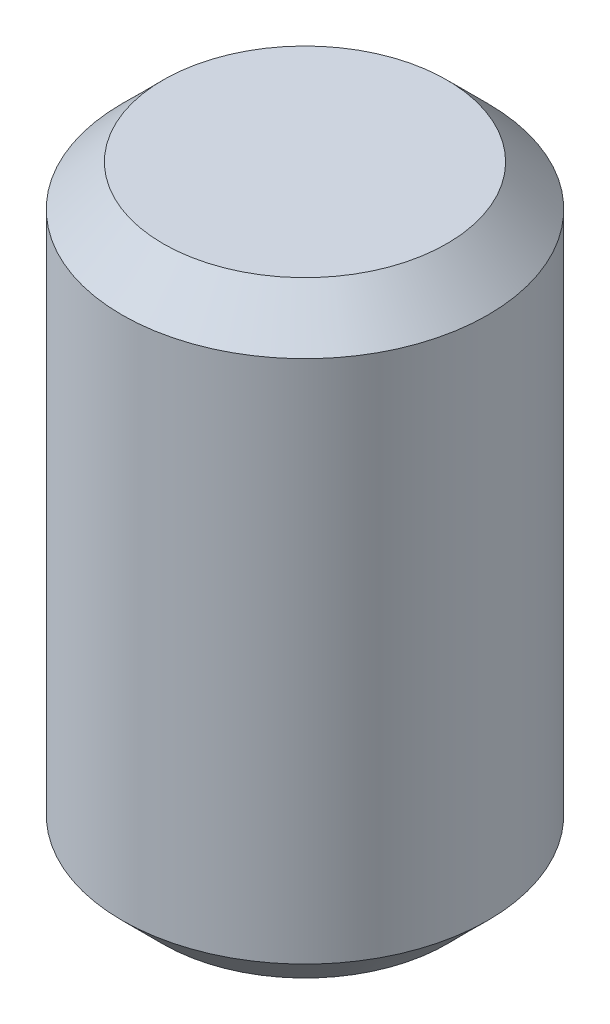
from build123d import *

# Parameters (mm, degrees)
SKETCH1_W          = 0.89
SKETCH1_H          = 2.95
CUT_EXTRUDE1_DEPTH = 0.375
CHAMFER1_SIZE      = 0.2


with BuildPart() as part:
    # Sketch1 → Revolve1 (revolve)
    with BuildSketch(Plane(origin=(0, 0, 0), x_dir=(-1, 0, 0), z_dir=(0, 0, -1)), mode=Mode.PRIVATE) as revolve1_sk:
        with Locations((-0.445, 1.475)):
            Rectangle(SKETCH1_W, SKETCH1_H)
    revolve(revolve1_sk.sketch.rotate(Axis((0, 0, 0), (0, 1, 0)), 270), axis=Axis((0, 0, 0), (0, 1, 0)))

    # Sketch2 → Cut-Extrude1 (cut)
    with BuildSketch(Plane.XZ):
        Polygon((-0.235, 0.40703194), (-0.47, 0), (-0.235, -0.40703194), (0.235, -0.40703194), (0.47, 0), (0.235, 0.40703194), align=None)
    extrude(amount=-CUT_EXTRUDE1_DEPTH, mode=Mode.SUBTRACT)

    # Chamfer1
    chamfer1_edges = [part.edges().sort_by_distance(p)[0] for p in [
        (0, 2.95, -0.89),
        (0, 0, -0.89),
    ]]
    chamfer(chamfer1_edges, length=CHAMFER1_SIZE)


solid = part.part
